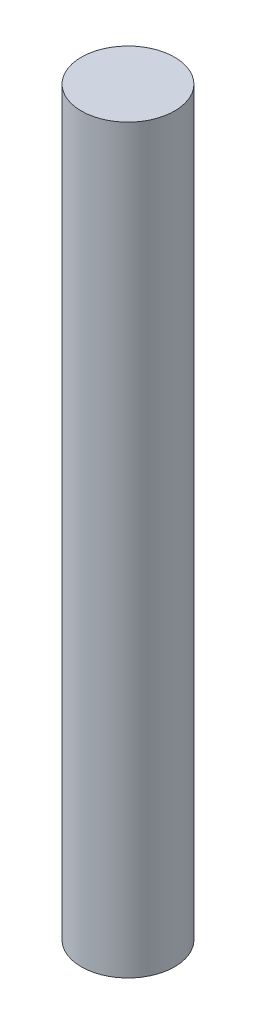
from build123d import *

# Parameters (mm, degrees)
SKETCH1_R           = 2.1082
BOSS_EXTRUDE1_DEPTH = 33.5


with BuildPart() as part:
    # Sketch1 → Boss-Extrude1 (new body)
    with BuildSketch(Plane(origin=(0, 0, 0), x_dir=(1, 0, 0), z_dir=(0, 1, 0))):
        with Locations(Location((0, 0, 0), (0, 0, 270))):
            Circle(SKETCH1_R)
    extrude(amount=BOSS_EXTRUDE1_DEPTH)


solid = part.part
